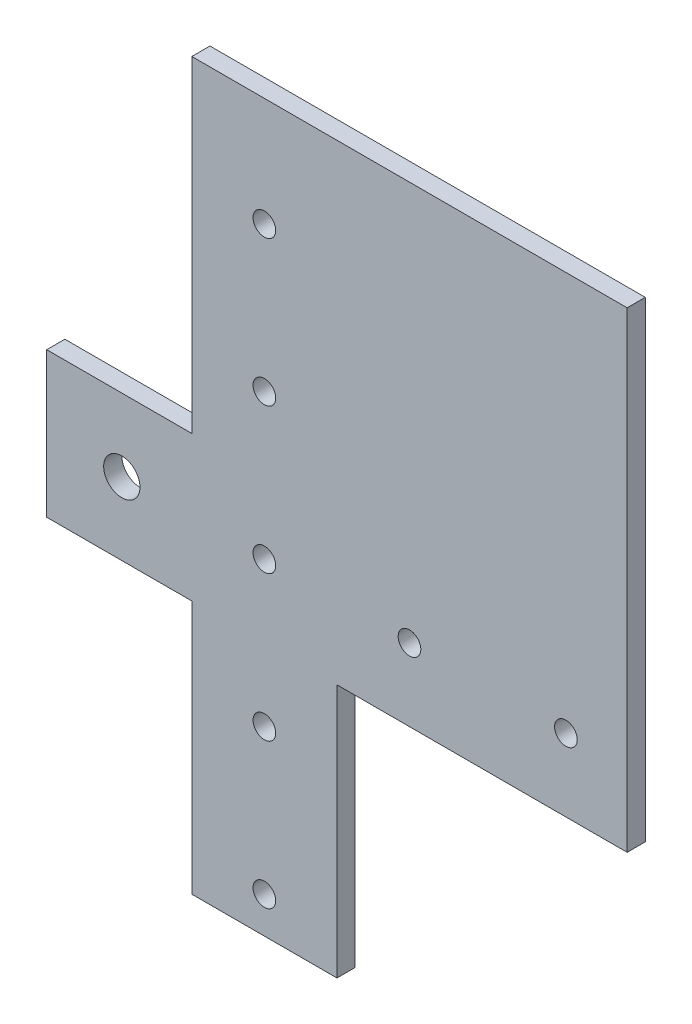
from build123d import *

# Parameters (mm, degrees)
SKETCH1_R           = 1.984375
SKETCH1_R_2         = 3.175
BOSS_EXTRUDE1_DEPTH = 3.175


with BuildPart() as part:
    # Sketch1 → Boss-Extrude1 (new body)
    with BuildSketch(Plane.XY):
        Polygon((25.4, 42.663065327), (25.4, -1.786934673), (50.8, -1.786934673), (50.8, 42.663065327), (101.6, 42.663065327), (101.6, 125.213065327), (25.4, 125.213065327), (25.4, 68.063065327), (0, 68.063065327), (0, 42.663065327), align=None)
        with Locations((38.1, 4.563065327)):
            Circle(SKETCH1_R, mode=Mode.SUBTRACT)
        with Locations((13.143553611, 55.363065327)):
            Circle(SKETCH1_R_2, mode=Mode.SUBTRACT)
        with Locations((38.1, 29.963065327)):
            Circle(SKETCH1_R, mode=Mode.SUBTRACT)
        with Locations((38.1, 55.363065327)):
            Circle(SKETCH1_R, mode=Mode.SUBTRACT)
        with Locations((63.5, 55.363065327)):
            Circle(SKETCH1_R, mode=Mode.SUBTRACT)
        with Locations((90.884375, 55.363065327)):
            Circle(SKETCH1_R, mode=Mode.SUBTRACT)
        with Locations((38.1, 80.763065327)):
            Circle(SKETCH1_R, mode=Mode.SUBTRACT)
        with Locations((38.1, 106.163065327)):
            Circle(SKETCH1_R, mode=Mode.SUBTRACT)
    extrude(amount=BOSS_EXTRUDE1_DEPTH)


solid = part.part
